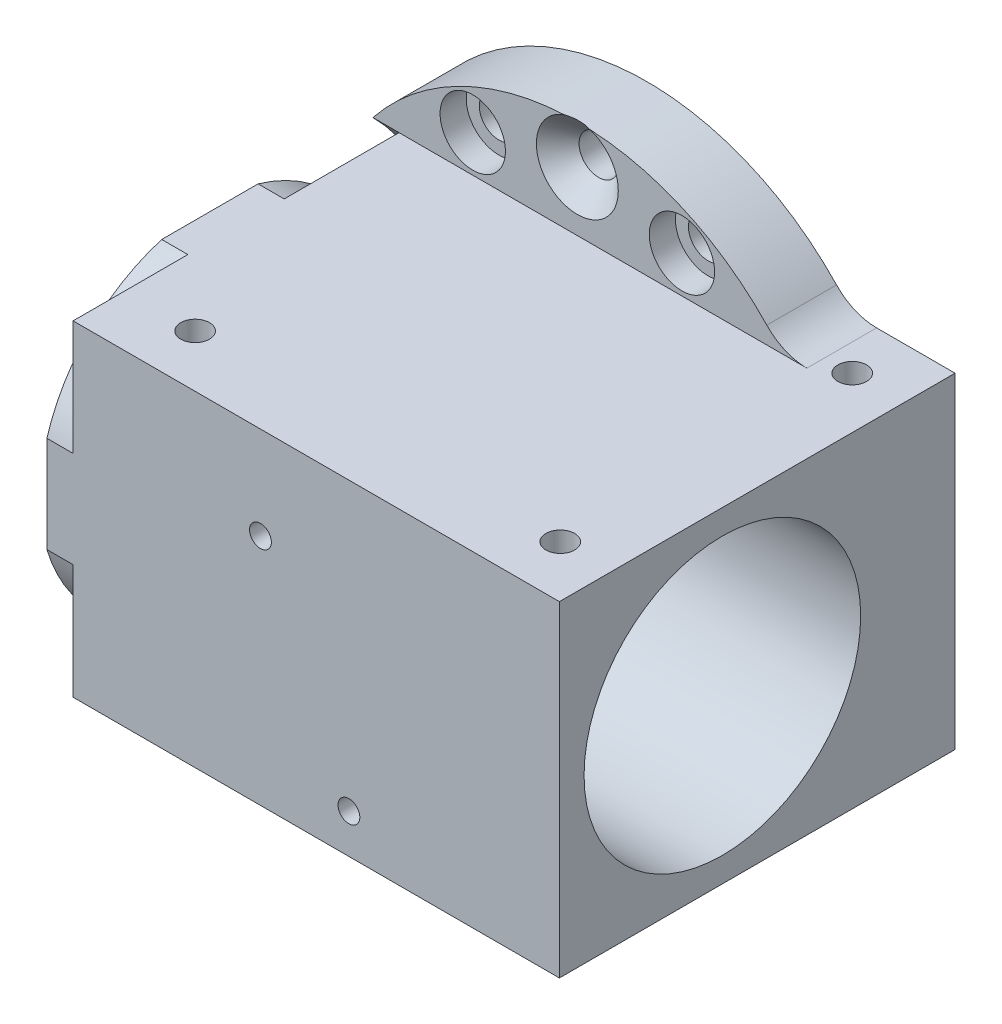
from build123d import *

# Parameters (mm, degrees)
BOSS_EXTRUDE1_DEPTH                                 = 8
CUT_EXTRUDE1_REACH                                  = 65.856
SKETCH4_W                                           = 55.8
SKETCH4_H                                           = 37.4
BOSS_EXTRUDE2_DEPTH                                 = 37.4
BOSS_EXTRUDE3_DEPTH                                 = 3
CUT_EXTRUDE2_START                                  = -3
CUT_EXTRUDE2_DEPTH                                  = 3
CUT_EXTRUDE3_START                                  = -3
CUT_EXTRUDE3_DEPTH                                  = 3
CSK_FOR_8_FLAT_HEAD_MACHINE_SCREW_100_D             = 4.5
CSK_FOR_8_FLAT_HEAD_MACHINE_SCREW_100_CSINK_D       = 9.4
CSK_FOR_8_FLAT_HEAD_MACHINE_SCREW_100_CSINK_ANGLE   = 90
F_4_CLEARANCE_HOLE1_D                               = 3.3
F_4_CLEARANCE_HOLE1_DEPTH                           = 6
CBORE_FOR_8_BINDING_HEAD_MACHINE_SCREW1_D           = 4.5
CBORE_FOR_8_BINDING_HEAD_MACHINE_SCREW1_CBORE_D     = 7.5
CBORE_FOR_8_BINDING_HEAD_MACHINE_SCREW1_CBORE_DEPTH = 3
FILLET1_R                                           = 6.35
M3X0_5_TAPPED_HOLE1_D                               = 2.5
M3X0_5_TAPPED_HOLE1_DEPTH                           = 4
M3X0_5_TAPPED_HOLE1_TIP                             = 0.751075774
FILLET2_R                                           = 6.35
SKETCH_1_R                                          = 1.65
CUT_EXTRUDE_1_DEPTH                                 = 6
EXTRUDE_START                                       = -6
SKETCH_2_R                                          = 1.65
EXTRUDE_1_DEPTH                                     = 6


with BuildPart() as part:
    # Sketch1 → Boss-Extrude1 (new body)
    with BuildSketch(Plane.XY.offset(8)):
        with BuildLine():
            Line((-23.45868709, 18.7), (-23.45868709, -18.7))
            ThreePointArc((-23.45868709, -18.7), (0, -30), (23.45868709, -18.7))
            Line((23.45868709, -18.7), (35.34131291, -18.7))
            Line((35.34131291, -18.7), (35.34131291, 18.7))
            Line((35.34131291, 18.7), (23.45868709, 18.7))
            ThreePointArc((23.45868709, 18.7), (0, 30), (-23.45868709, 18.7))
        make_face()
    extrude(amount=-BOSS_EXTRUDE1_DEPTH)

    # Sketch3 → Cut-Extrude1 (cut, up to next)
    with BuildSketch(Plane(origin=(-20.45868709, 0, 0), x_dir=(0, 0, -1), z_dir=(1, 0, 0)), mode=Mode.PRIVATE) as cut_extrude1_sk1:
        with BuildLine():
            Line((-8, 18.7), (-8, -18.7))
            ThreePointArc((-8, -18.7), (-0.254206384, 0), (-8, 18.7))
        make_face()
    cut_extrude1_tool1 = extrude(cut_extrude1_sk1.sketch, amount=-CUT_EXTRUDE1_REACH, mode=Mode.PRIVATE) & part.part
    add(cut_extrude1_tool1.solids().sort_by_distance((-20.458687, 0, 4.859168))[0], mode=Mode.SUBTRACT)

    # Sketch4 → Boss-Extrude2 (add)
    with BuildSketch(Plane.XY.offset(8)):
        with Locations((7.44131291, 0)):
            Rectangle(SKETCH4_W, SKETCH4_H)
    extrude(amount=BOSS_EXTRUDE2_DEPTH)

    # Sketch5 → Boss-Extrude3 (add)
    with BuildSketch(Plane.ZY.offset(20.45868709)):
        with BuildLine():
            Line((21.171890016, 18.7), (45.4, 18.7))
            Line((45.4, 18.7), (45.4, -18.7))
            Line((45.4, -18.7), (21.171890016, -18.7))
            ThreePointArc((21.171890016, -18.7), (7.2, 0), (21.171890016, 18.7))
        make_face()
    extrude(amount=BOSS_EXTRUDE3_DEPTH)

    # Sketch6 → Cut-Extrude2 (cut)
    with BuildSketch(Plane.ZY.offset(23.45868709).offset(CUT_EXTRUDE2_START)):
        with BuildLine():
            Line((45.4, -18.7), (45.4, -5.528109984))
            ThreePointArc((45.4, -5.528109984), (40.488582233, -13.788582233), (32.228109984, -18.7))
            Line((32.228109984, -18.7), (45.4, -18.7))
        make_face()
    extrude(amount=CUT_EXTRUDE2_DEPTH, mode=Mode.SUBTRACT)

    # Sketch7 → Cut-Extrude3 (cut)
    with BuildSketch(Plane.ZY.offset(23.45868709).offset(CUT_EXTRUDE3_START)):
        with BuildLine():
            Line((45.4, 18.7), (32.228109984, 18.7))
            ThreePointArc((32.228109984, 18.7), (40.488582233, 13.788582233), (45.4, 5.528109984))
            Line((45.4, 5.528109984), (45.4, 18.7))
        make_face()
    extrude(amount=CUT_EXTRUDE3_DEPTH, mode=Mode.SUBTRACT)

    # Sketch8 → Cut-Revolve1 (revolve, cut)
    with BuildSketch(Plane.XY.offset(26.7)):
        Polygon((-23.45868709, 15.86865), (-23.45868709, 0), (35.34131291, 0), (35.34131291, 15.86865), (9.94131291, 15.86865), (9.94131291, 13.5), (1.94131291, 13.5), (1.94131291, 15.86865), align=None)
    revolve(axis=Axis((-23.45868709, 0, 26.7), (1, 0, 0)), mode=Mode.SUBTRACT)

    # CSK for #8 Flat Head Machine Screw (100)1 (through all)
    with Locations(Plane.XY.offset(8)):
        with Locations((0, 25.5), (0, -25.5)):
            CounterSinkHole(CSK_FOR_8_FLAT_HEAD_MACHINE_SCREW_100_D / 2, CSK_FOR_8_FLAT_HEAD_MACHINE_SCREW_100_CSINK_D / 2, counter_sink_angle=CSK_FOR_8_FLAT_HEAD_MACHINE_SCREW_100_CSINK_ANGLE)

    # #4 Clearance Hole1
    with Locations(Plane(origin=(0, -18.7, 0), x_dir=(-1, 0, 0), z_dir=(0, -1, 0))):
        with Locations((12.45868709, -39.4), (-29.44131291, -39.4), (-29.44131291, -5.9)):
            Hole(F_4_CLEARANCE_HOLE1_D / 2, depth=F_4_CLEARANCE_HOLE1_DEPTH)

    # CBORE for #8 Binding Head Machine Screw1 (through all)
    with Locations(Plane.XY.offset(8)):
        with Locations((12, 22.95), (-12, 22.95), (-12, -22.95), (12, -22.95)):
            CounterBoreHole(CBORE_FOR_8_BINDING_HEAD_MACHINE_SCREW1_D / 2, CBORE_FOR_8_BINDING_HEAD_MACHINE_SCREW1_CBORE_D / 2, CBORE_FOR_8_BINDING_HEAD_MACHINE_SCREW1_CBORE_DEPTH)

    # Fillet1
    fillet1_edges = [part.edges().sort_by_distance(p)[0] for p in [
        (23.45868709, 18.7, 4),
    ]]
    fillet(fillet1_edges, radius=FILLET1_R)

    # M3x0.5 Tapped Hole1
    with Locations(Plane(origin=(1.04131291, 8.07366885, 45.4), x_dir=(1, 0, 0), z_dir=(0, 0, 1))):
        with Locations((0, 0), (10.150400418, -22.272670952)):
            Hole(M3X0_5_TAPPED_HOLE1_D / 2, depth=M3X0_5_TAPPED_HOLE1_DEPTH)
            with Locations((0, 0, -(M3X0_5_TAPPED_HOLE1_DEPTH + M3X0_5_TAPPED_HOLE1_TIP / 2))):  # 118° drill point
                Cone(0, M3X0_5_TAPPED_HOLE1_D / 2, M3X0_5_TAPPED_HOLE1_TIP, mode=Mode.SUBTRACT)

    # Fillet2
    fillet2_edges = [part.edges().sort_by_distance(p)[0] for p in [
        (23.45868709, -18.7, 4),
    ]]
    fillet(fillet2_edges, radius=FILLET2_R)

    # 草图1 → 切除-拉伸1 (cut)
    with BuildSketch(Plane(origin=(0, 18.7, 0), x_dir=(1, 0, 0), z_dir=(0, 1, 0))):
        with Locations(Location((29.44131291, -5.9, 0), (0, 0, 90))):
            Circle(SKETCH_1_R)
        with Locations(Location((-12.45868709, -39.4, 0), (0, 0, 90))):
            Circle(SKETCH_1_R)
        with Locations(Location((29.44131291, -39.4, 0), (0, 0, 90))):
            Circle(SKETCH_1_R)
    extrude(amount=-CUT_EXTRUDE_1_DEPTH, mode=Mode.SUBTRACT)

    # 草图2 → 凸台-拉伸1 (add)
    with BuildSketch(Plane.XZ.offset(18.7).offset(EXTRUDE_START)):
        with Locations(Location((29.44131291, 5.9, 0), (0, 0, 180))):
            Circle(SKETCH_2_R)
        with Locations(Location((29.44131291, 39.4, 0), (0, 0, 180))):
            Circle(SKETCH_2_R)
        with Locations(Location((-12.45868709, 39.4, 0), (0, 0, 180))):
            Circle(SKETCH_2_R)
    extrude(amount=EXTRUDE_1_DEPTH)


solid = part.part
